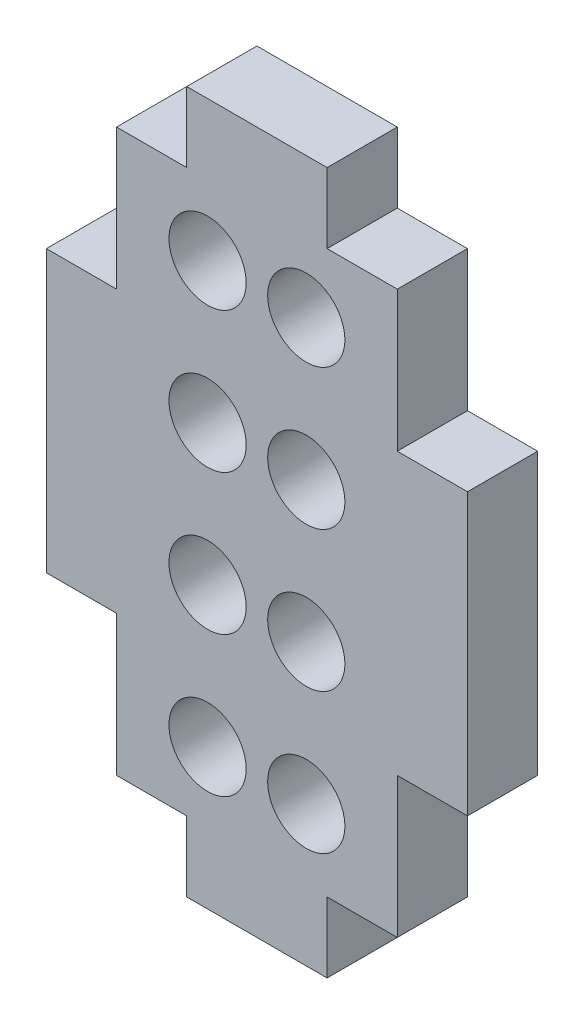
from build123d import *

# Parameters (mm, degrees)
BOSS_EXTRUDE1_DEPTH = 5
SKETCH2_R           = 2.75
CUT_EXTRUDE1_DEPTH  = 53.376168941


with BuildPart() as part:
    # Sketch1 → Boss-Extrude1 (new body)
    with BuildSketch(Plane.XY):
        Polygon((22.999000463, 20.515274598), (32.999000463, 20.515274598), (32.999000463, 15.515274598), (37.999000463, 15.515274598), (37.999000463, 5.515274598), (42.999000463, 5.515274598), (42.999000463, -14.484725402), (37.999000463, -14.484725402), (37.999000463, -24.484725402), (32.999000463, -24.484725402), (32.999000463, -29.484725402), (22.999000463, -29.484725402), (22.999000463, -24.484725402), (17.999000463, -24.484725402), (17.999000463, -14.484725402), (12.999000463, -14.484725402), (12.999000463, 5.515274598), (17.999000463, 5.515274598), (17.999000463, 15.515274598), (22.999000463, 15.515274598), align=None)
    extrude(amount=BOSS_EXTRUDE1_DEPTH)

    # Sketch2 → Cut-Extrude1 (cut, through all)
    with BuildSketch(Plane.XY.offset(5)):
        with Locations((24.48386892, 10.515274598)):
            Circle(SKETCH2_R)
        with Locations((24.48386892, 0.515274598)):
            Circle(SKETCH2_R)
        with Locations((24.48386892, -9.484725402)):
            Circle(SKETCH2_R)
        with Locations((24.48386892, -19.484725402)):
            Circle(SKETCH2_R)
        with Locations(Location((31.514132006, -19.484725402, 0), (0, 0, 180))):
            Circle(SKETCH2_R)
        with Locations(Location((31.514132006, -9.484725402, 0), (0, 0, 180))):
            Circle(SKETCH2_R)
        with Locations(Location((31.514132006, 0.515274598, 0), (0, 0, 180))):
            Circle(SKETCH2_R)
        with Locations(Location((31.514132006, 10.515274598, 0), (0, 0, 180))):
            Circle(SKETCH2_R)
    extrude(amount=-CUT_EXTRUDE1_DEPTH, mode=Mode.SUBTRACT)


solid = part.part
